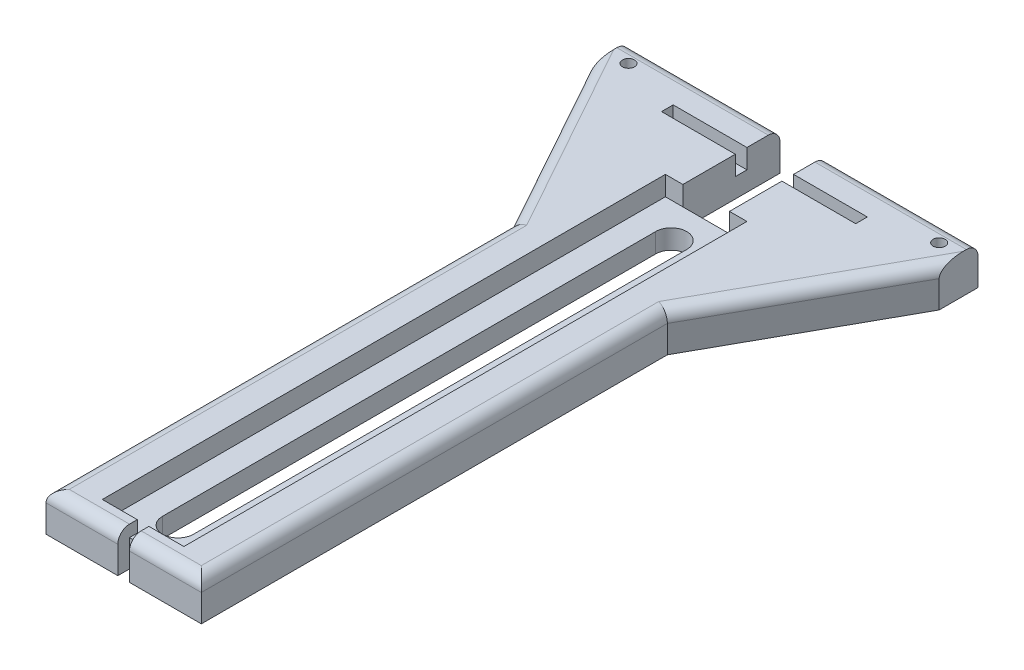
from build123d import *

# Parameters (mm, degrees)
SKETCH1_R           = 1.55
BOSS_EXTRUDE1_DEPTH = 10
SKETCH2_W           = 10.5
SKETCH2_H           = 145
CUT_EXTRUDE1_DEPTH  = 5
SKETCH3_W           = 12
SKETCH3_H           = 25
CUT_EXTRUDE2_DEPTH  = 181.969610709
SKETCH4_W           = 50
SKETCH4_H           = 3
CUT_EXTRUDE3_DEPTH  = 5
FILLET1_R           = 3
SKETCH6_R           = 1.55
CUT_EXTRUDE4_DEPTH  = 5
CHAMFER2_SIZE       = 1
SKETCH7_W           = 3
SKETCH7_H           = 3
CUT_EXTRUDE5_DEPTH  = 12
SKETCH8_W           = 3
SKETCH8_H           = 3
CUT_EXTRUDE6_DEPTH  = 181.828648173


with BuildPart() as part:
    # Sketch1 → Boss-Extrude1 (new body)
    with BuildSketch(Plane(origin=(0, 0, 0), x_dir=(1, 0, 0), z_dir=(0, 1, 0))):
        with BuildLine():
            Line((0, -30), (0, 0))
            Line((0, 0), (-45, 0))
            Line((-45, 0), (-45, -10))
            Line((-45, -10), (-20, -55))
            Line((-20, -55), (-20, -175))
            Line((-20, -175), (0, -175))
            Line((0, -175), (0, -165))
            ThreePointArc((0, -165), (-2.828427125, -163.828427125), (-4, -161))
            Line((-4, -161), (-4, -34))
            ThreePointArc((-4, -34), (-2.828427125, -31.171572875), (0, -30))
        make_face()
        with Locations(Location((-40, -5, 0), (0, 0, 270))):
            Circle(SKETCH1_R, mode=Mode.SUBTRACT)
    boss_extrude1 = extrude(amount=BOSS_EXTRUDE1_DEPTH)

    # Sketch2 → Cut-Extrude1 (cut)
    with BuildSketch(Plane(origin=(0, 10, 0), x_dir=(1, 0, 0), z_dir=(0, 1, 0))):
        with Locations((-5.25, -97.5)):
            Rectangle(SKETCH2_W, SKETCH2_H)
    cut_extrude1 = extrude(amount=-CUT_EXTRUDE1_DEPTH, mode=Mode.SUBTRACT)

    # Mirror1: Boss-Extrude1, Cut-Extrude1 across plane
    add(boss_extrude1.mirror(Plane(origin=(0, 0, 0), x_dir=(0, 0, 1), z_dir=(1, 0, 0))))
    add(cut_extrude1.mirror(Plane(origin=(0, 0, 0), x_dir=(0, 0, 1), z_dir=(1, 0, 0))), mode=Mode.SUBTRACT)

    # Sketch3 → Cut-Extrude2 (cut, through all)
    with BuildSketch(Plane(origin=(0, 10, 0), x_dir=(1, 0, 0), z_dir=(0, 1, 0))):
        with Locations((0, -12.5)):
            Rectangle(SKETCH3_W, SKETCH3_H)
    extrude(amount=-CUT_EXTRUDE2_DEPTH, mode=Mode.SUBTRACT)

    # Sketch4 → Cut-Extrude3 (cut)
    with BuildSketch(Plane(origin=(0, 10, 0), x_dir=(1, 0, 0), z_dir=(0, 1, 0))):
        with Locations((0, -10)):
            Rectangle(SKETCH4_W, SKETCH4_H)
    extrude(amount=-CUT_EXTRUDE3_DEPTH, mode=Mode.SUBTRACT)

    # Fillet1
    fillet1_edges = [part.edges().sort_by_distance(p)[0] for p in [
        (-25.5, 10, 0),
        (25.5, 10, 0),
        (-32.5, 10, 32.5),
        (-20, 10, 115),
        (0, 10, 175),
        (20, 10, 115),
        (32.5, 10, 32.5),
    ]]
    fillet(fillet1_edges, radius=FILLET1_R)

    # Sketch6 → Cut-Extrude4 (cut)
    # profile 1 of 2: a face of its own
    with BuildSketch(Plane.XZ):
        Polygon((-42.416024464, 2.82621855), (-39.325462274, 1.820770713), (-36.90943781, 3.994552163), (-37.583975536, 7.17378145), (-40.674537726, 8.179229287), (-43.09056219, 6.005447837), align=None)
        with Locations(Location((-40, 5, 0), (0, 0, 270))):
            Circle(SKETCH6_R, mode=Mode.SUBTRACT)
    # profile 2 of 2: a face of its own
    with BuildSketch(Plane.XZ):
        Polygon((36.81146344, 4.370925598), (38.950526133, 1.924109137), (42.139062693, 2.553183539), (43.18853656, 5.629074402), (41.049473867, 8.075890863), (37.860937307, 7.446816461), align=None)
        with Locations(Location((40, 5, 0), (0, 0, 270))):
            Circle(SKETCH6_R, mode=Mode.SUBTRACT)
    extrude(amount=-CUT_EXTRUDE4_DEPTH, mode=Mode.SUBTRACT)

    # Chamfer2
    chamfer2_edges = [part.edges().sort_by_distance(p)[0] for p in [
        (-40.870743369, 5, 2.323494632),
        (-42.753293327, 5, 4.415833194),
        (-41.882549958, 5, 7.092338562),
        (-39.129256631, 5, 7.676505368),
        (-37.246706673, 5, 5.584166806),
        (-38.117450042, 5, 2.907661438),
        (37.880994786, 5, 3.147517367),
        (37.336200373, 5, 5.908871029),
        (39.455205587, 5, 7.761353662),
        (42.119005214, 5, 6.852482633),
        (42.663799627, 5, 4.091128971),
        (40.544794413, 5, 2.238646338),
    ]]
    chamfer(chamfer2_edges, length=CHAMFER2_SIZE)

    # Sketch7 → Cut-Extrude5 (cut)
    with BuildSketch(Plane.XY.offset(175)):
        with Locations((0, 8.5)):
            Rectangle(SKETCH7_W, SKETCH7_H)
        with Locations((0, 1.5)):
            Rectangle(SKETCH7_W, SKETCH7_H)
    extrude(amount=-CUT_EXTRUDE5_DEPTH, mode=Mode.SUBTRACT)

    # Sketch8 → Cut-Extrude6 (cut, through all)
    with BuildSketch(Plane(origin=(0, 7, 0), x_dir=(1, 0, 0), z_dir=(0, 1, 0))):
        with Locations((0, -173.5)):
            Rectangle(SKETCH8_W, SKETCH8_H)
    extrude(amount=-CUT_EXTRUDE6_DEPTH, mode=Mode.SUBTRACT)


solid = part.part
